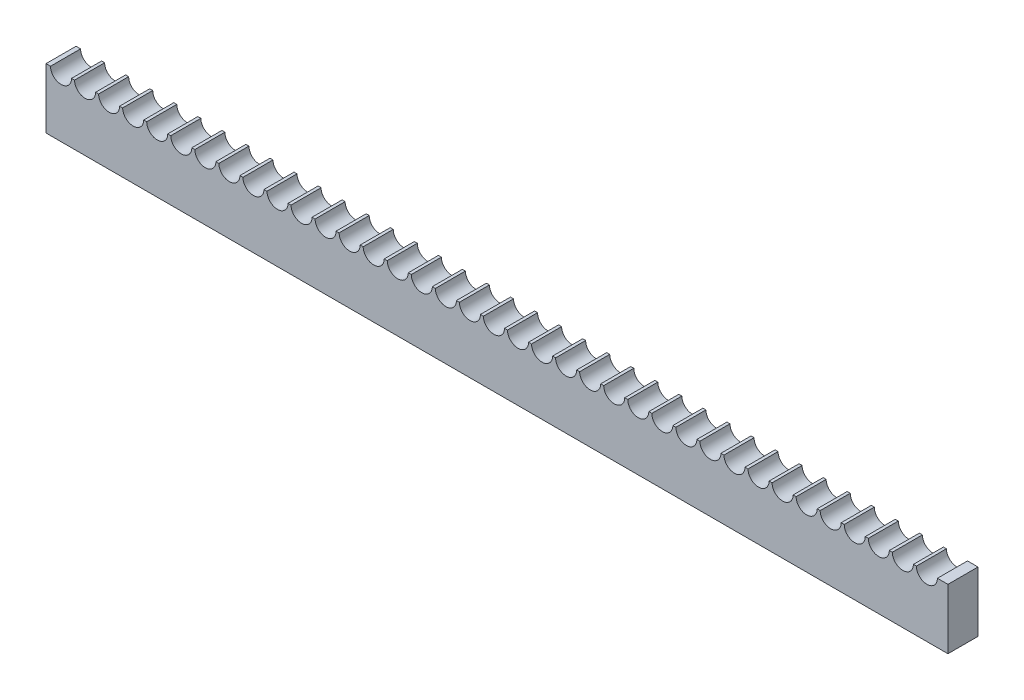
from build123d import *

# Parameters (mm, degrees)
SKETCH1_W           = 381
SKETCH1_H           = 25.4
BOSS_EXTRUDE1_DEPTH = 12.7
CUT_EXTRUDE1_REACH  = 194.605
SKETCH2_R           = 4.445
LPATTERN1_COUNT     = 37
LPATTERN1_PITCH     = 10.16


with BuildPart() as part:
    # Sketch1 → Boss-Extrude1 (new body)
    with BuildSketch(Plane.XY):
        with Locations((0, 12.7)):
            Rectangle(SKETCH1_W, SKETCH1_H)
    extrude(amount=BOSS_EXTRUDE1_DEPTH)

    # Sketch2 → Cut-Extrude1 (cut, up to next)
    with BuildSketch(Plane.XY.offset(12.7), mode=Mode.PRIVATE) as cut_extrude1_sk1:
        with Locations((-184.15, 25.4)):
            Circle(SKETCH2_R)
    cut_extrude1_tool1 = extrude(cut_extrude1_sk1.sketch, amount=-CUT_EXTRUDE1_REACH, mode=Mode.PRIVATE) & part.part
    cut_extrude1 = cut_extrude1_tool1.solids().sort_by_distance((-184.15, 25.4, 12.7))[0]
    add(cut_extrude1, mode=Mode.SUBTRACT)

    # LPattern1: Cut-Extrude1 ×37
    with Locations(*[(i * LPATTERN1_PITCH, 0, 0) for i in range(1, LPATTERN1_COUNT)]):
        add(cut_extrude1, mode=Mode.SUBTRACT)


solid = part.part
